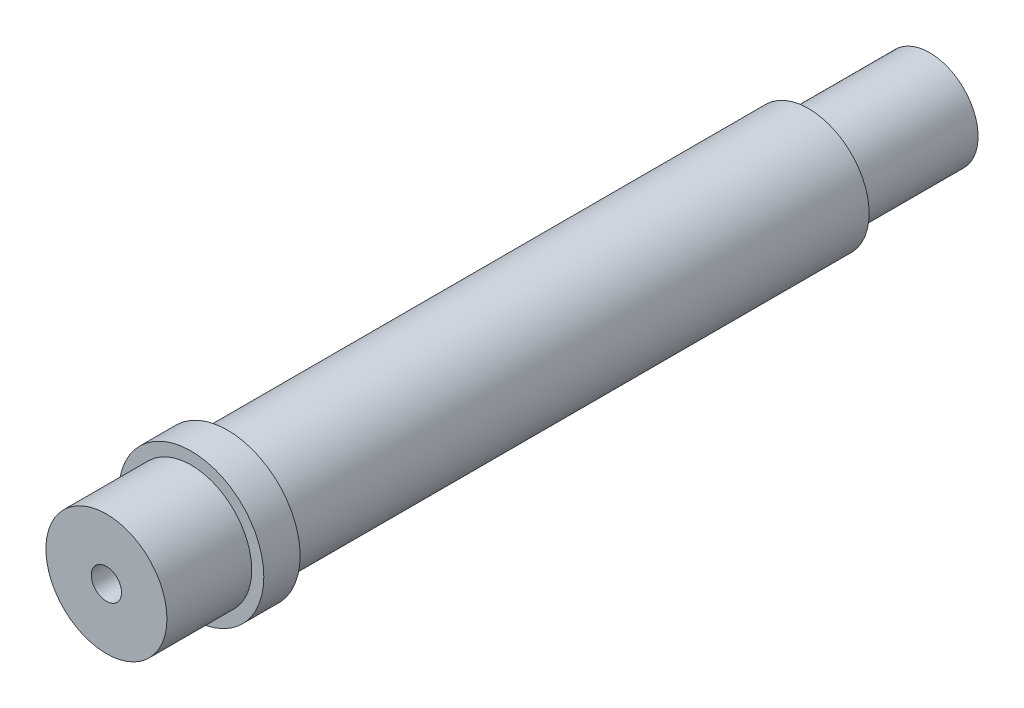
from build123d import *

# Parameters (mm, degrees)
SKETCH_1_R          = 5
EXTRUDE_1_DEPTH     = 48
SKETCH_2_R          = 6
EXTRUDE_2_DEPTH     = 3
SKETCH_3_R          = 5
EXTRUDE_3_DEPTH     = 7
SKETCH_5_R          = 4
EXTRUDE_4_DEPTH     = 10
SKETCH_6_R          = 1.25
CUT_EXTRUDE_1_DEPTH = 10
CUT_EXTRUDE_START   = -10
SKETCH_7_R          = 1.25
CUT_EXTRUDE_2_DEPTH = 10


with BuildPart() as part:
    # 草图1 → 凸台-拉伸1 (new body)
    with BuildSketch(Plane.XY):
        Circle(SKETCH_1_R)
    extrude(amount=EXTRUDE_1_DEPTH)

    # 草图2 → 凸台-拉伸2 (add)
    with BuildSketch(Plane.XY.offset(48)):
        Circle(SKETCH_2_R)
    extrude(amount=EXTRUDE_2_DEPTH)

    # 草图3 → 凸台-拉伸3 (add)
    with BuildSketch(Plane.XY.offset(51)):
        Circle(SKETCH_3_R)
    extrude(amount=EXTRUDE_3_DEPTH)

    # 草图5 → 凸台-拉伸4 (add)
    with BuildSketch(Plane(origin=(0, 0, 0), x_dir=(-1, 0, 0), z_dir=(0, 0, -1))):
        Circle(SKETCH_5_R)
    extrude(amount=EXTRUDE_4_DEPTH)

    # 草图6 → 切除-拉伸1 (cut)
    with BuildSketch(Plane.XY.offset(58)):
        Circle(SKETCH_6_R)
    extrude(amount=-CUT_EXTRUDE_1_DEPTH, mode=Mode.SUBTRACT)

    # 草图7 → 切除-拉伸2 (cut)
    with BuildSketch(Plane(origin=(0, 0, -10), x_dir=(-1, 0, 0), z_dir=(0, 0, -1)).offset(CUT_EXTRUDE_START)):
        with Locations(Location((0, 0, 0), (0, 0, 180))):
            Circle(SKETCH_7_R)
    extrude(amount=CUT_EXTRUDE_2_DEPTH, mode=Mode.SUBTRACT)


solid = part.part
